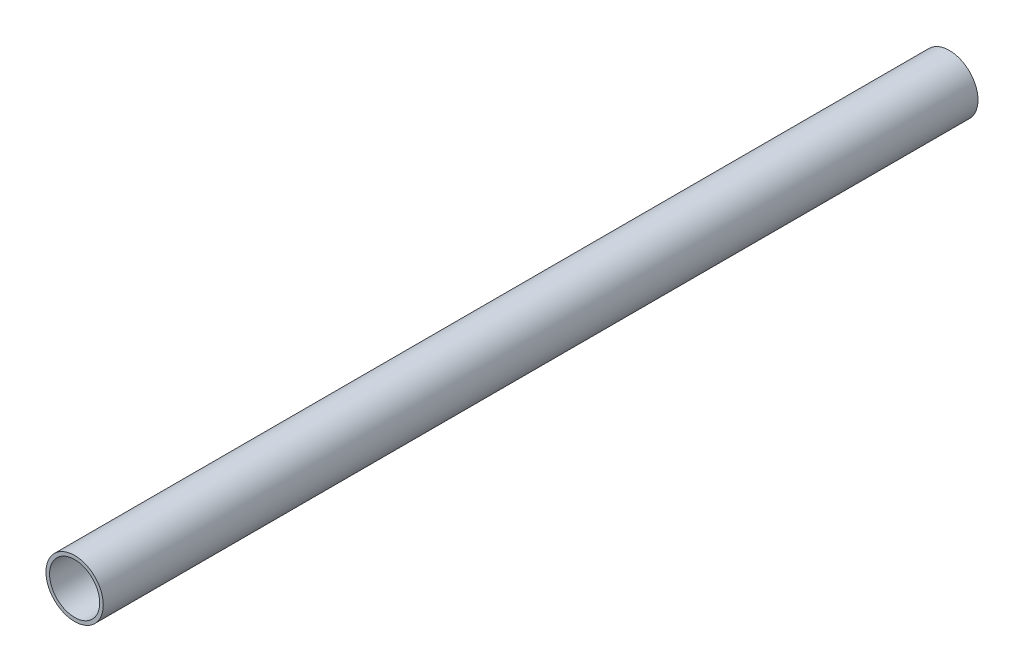
from build123d import *

# Parameters (mm, degrees)
SKETCH1_R           = 12.7
SKETCH1_R_2         = 11.1125
BOSS_EXTRUDE1_DEPTH = 387.62


with BuildPart() as part:
    # Sketch1 → Boss-Extrude1 (new body)
    with BuildSketch(Plane.XY):
        Circle(SKETCH1_R)
        Circle(SKETCH1_R_2, mode=Mode.SUBTRACT)
    extrude(amount=BOSS_EXTRUDE1_DEPTH)


solid = part.part
